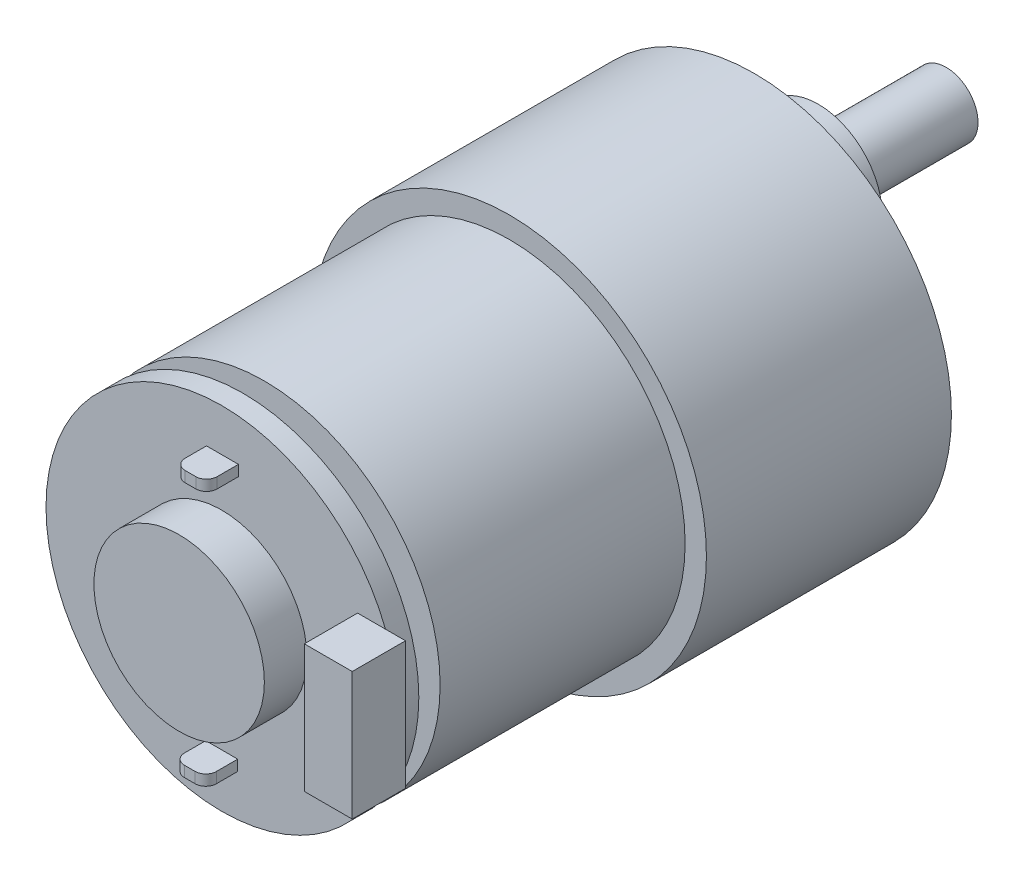
from build123d import *

# Parameters (mm, degrees)
SKETCH_1_R          = 18.5
EXTRUDE_3_DEPTH     = 23
SKETCH_3_R          = 16.5
EXTRUDE_4_DEPTH     = 23
SKETCH_4_R          = 6
EXTRUDE_5_DEPTH     = 6
SKETCH_6_R          = 3
EXTRUDE_6_DEPTH     = 12
SKETCH_7_R          = 2
EXTRUDE_7_DEPTH     = 2
SKETCH_8_W          = 3
SKETCH_8_H          = 1
EXTRUDE_8_DEPTH     = 7
SKETCH_9_R          = 16.5
EXTRUDE_9_DEPTH     = 2
SKETCH_10_W         = 4.5
SKETCH_10_H         = 12
EXTRUDE_10_DEPTH    = 5
FILLET_1_R          = 1
SKETCH_11_R         = 8
EXTRUDE_11_DEPTH    = 4
SKETCH_12_R         = 1.6
CUT_EXTRUDE_1_DEPTH = 2


with BuildPart() as part:
    # 草图1 → 凸台-拉伸3 (new body)
    with BuildSketch(Plane.XY):
        Circle(SKETCH_1_R)
    extrude(amount=EXTRUDE_3_DEPTH)

    # 草图3 → 凸台-拉伸4 (add)
    with BuildSketch(Plane.XY.offset(23)):
        Circle(SKETCH_3_R)
    extrude(amount=EXTRUDE_4_DEPTH)

    # 草图4 → 凸台-拉伸5 (add)
    with BuildSketch(Plane(origin=(0, 0, 0), x_dir=(-1, 0, 0), z_dir=(0, 0, -1))):
        with Locations(Location((0, 7, 0), (0, 0, 180))):
            Circle(SKETCH_4_R)
    extrude(amount=EXTRUDE_5_DEPTH)

    # 草图6 → 凸台-拉伸6 (add)
    with BuildSketch(Plane(origin=(0, 0, -6), x_dir=(-1, 0, 0), z_dir=(0, 0, -1))):
        with Locations((0, 7)):
            Circle(SKETCH_6_R)
    extrude(amount=EXTRUDE_6_DEPTH)

    # 草图7 → 凸台-拉伸7 (add)
    with BuildSketch(Plane.XY.offset(46)):
        Circle(SKETCH_7_R)
    extrude(amount=EXTRUDE_7_DEPTH)

    # 草图8 → 凸台-拉伸8 (add)
    with BuildSketch(Plane.XY.offset(46)):
        with Locations((0, -12)):
            Rectangle(SKETCH_8_W, SKETCH_8_H)
        with Locations((0.066509227, 12)):
            Rectangle(SKETCH_8_W, SKETCH_8_H)
    extrude(amount=EXTRUDE_8_DEPTH)

    # 草图9 → 凸台-拉伸9 (add)
    with BuildSketch(Plane.XY.offset(48)):
        Circle(SKETCH_9_R)
    extrude(amount=EXTRUDE_9_DEPTH)

    # 草图10 → 凸台-拉伸10 (add)
    with BuildSketch(Plane.XY.offset(50)):
        with Locations((15, 0)):
            Rectangle(SKETCH_10_W, SKETCH_10_H)
    extrude(amount=EXTRUDE_10_DEPTH)

    # 圆角1
    fillet_1_edges = [part.edges().sort_by_distance(p)[0] for p in [
        (1.566509227, 12, 53),
        (-1.433490773, 12, 53),
        (1.5, -12, 53),
        (-1.5, -12, 53),
    ]]
    fillet(fillet_1_edges, radius=FILLET_1_R)

    # 草图11 → 凸台-拉伸11 (add)
    with BuildSketch(Plane.XY.offset(50)):
        Circle(SKETCH_11_R)
    extrude(amount=EXTRUDE_11_DEPTH)

    # 草图12 → 切除-拉伸1 (cut)
    with BuildSketch(Plane(origin=(0, 0, 0), x_dir=(-1, 0, 0), z_dir=(0, 0, -1))):
        with Locations((15.5, 0)):
            Circle(SKETCH_12_R)
        with Locations((7.75, -13.423393759)):
            Circle(SKETCH_12_R)
        with Locations((-7.75, -13.423393759)):
            Circle(SKETCH_12_R)
        with Locations((-15.5, 0)):
            Circle(SKETCH_12_R)
        with Locations((-7.75, 13.423393759)):
            Circle(SKETCH_12_R)
        with Locations((7.75, 13.423393759)):
            Circle(SKETCH_12_R)
    extrude(amount=-CUT_EXTRUDE_1_DEPTH, mode=Mode.SUBTRACT)


solid = part.part
